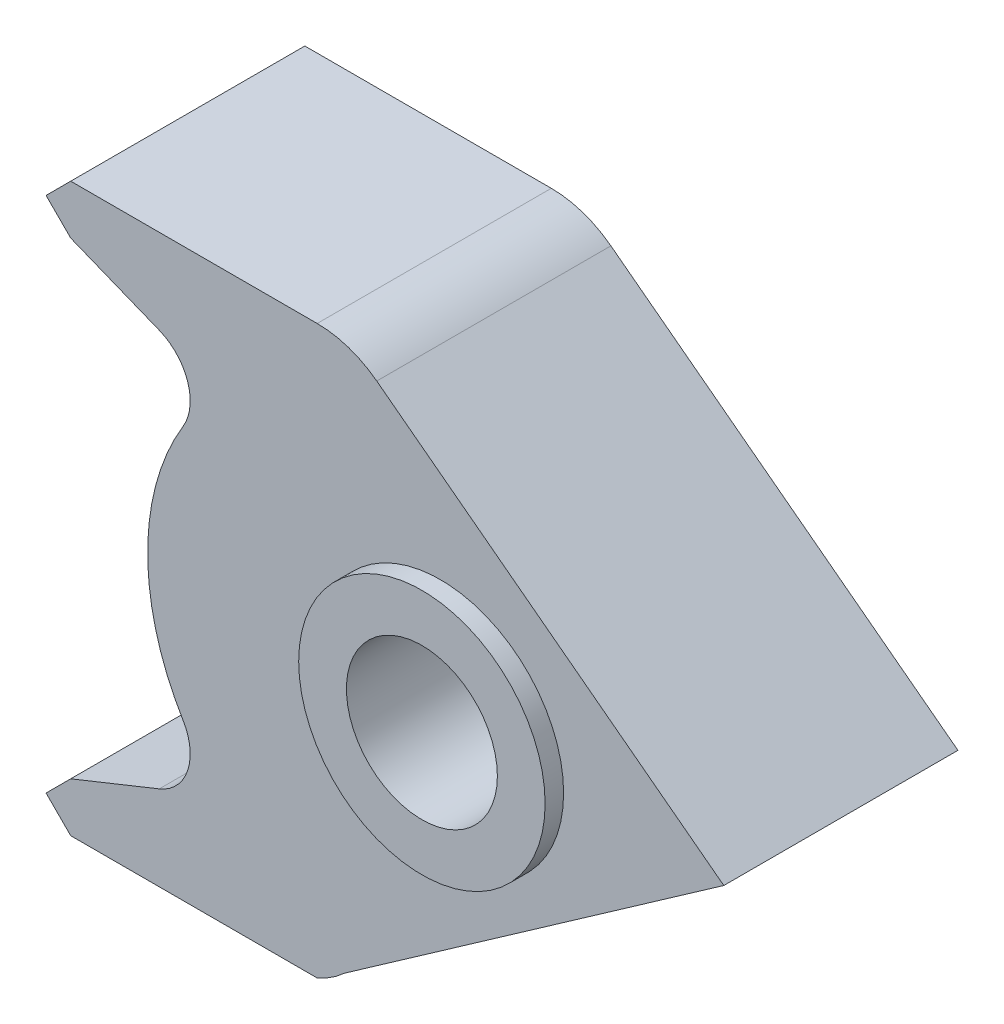
from build123d import *

# Parameters (mm, degrees)
ESBO_O1_R                = 6.125
RESSALTO_EXTRUS_O1_DEPTH = 22
ESBO_O2_OUTSIDE_W        = 72
ESBO_O2_OUTSIDE_H        = 63
ESBO_O2_OUTSIDE_R        = 10
CORTE_EXTRUS_O1_DEPTH    = 1.5
ESBO_O3_OUTSIDE_W        = 72
ESBO_O3_OUTSIDE_H        = 63
ESBO_O3_OUTSIDE_R        = 10
CORTE_EXTRUS_O2_DEPTH    = 1.5


with BuildPart() as part:
    # Esboço1 → Ressalto-extrusão1 (new body)
    with BuildSketch(Plane.XY):
        with BuildLine():
            ThreePointArc((-30.781182975, -21.553216354), (-31.830295908, -22.369078713), (-33, -23))
            Line((-33, -23), (-53, -23))
            Line((-53, -23), (-55, -21))
            Line((-55, -21), (-53, -19))
            Line((-53, -19), (-45.812043902, -16.114839283))
            ThreePointArc((-45.812043902, -16.114839283), (-43.50890364, -13.67237999), (-43.877574187, -10.335593438))
            ThreePointArc((-43.877574187, -10.335593438), (-46.755205534, 0), (-43.877574187, 10.335593438))
            ThreePointArc((-43.877574187, 10.335593438), (-43.50890364, 13.67237999), (-45.812043902, 16.114839283))
            Line((-45.812043902, 16.114839283), (-53, 19))
            Line((-53, 19), (-55, 21))
            Line((-55, 21), (-53, 23))
            Line((-53, 23), (-33, 23))
            ThreePointArc((-33, 23), (-30.448735361, 22.582285193), (-28.163895976, 21.372762185))
            Line((-28.163895976, 21.372762185), (0, 0))
            Line((0, 0), (-30.781182975, -21.553216354))
        make_face()
        with Locations((-23, 0)):
            Circle(ESBO_O1_R, mode=Mode.SUBTRACT)
    extrude(amount=RESSALTO_EXTRUS_O1_DEPTH)

    # Esboço2 outside → Corte-extrusão1 (cut)
    with BuildSketch(Plane.XY.offset(22)):
        with Locations((-27.5, 0)):
            Rectangle(ESBO_O2_OUTSIDE_W, ESBO_O2_OUTSIDE_H)
        with Locations((-23, 0)):
            Circle(ESBO_O2_OUTSIDE_R, mode=Mode.SUBTRACT)
    extrude(amount=-CORTE_EXTRUS_O1_DEPTH, mode=Mode.SUBTRACT)

    # Esboço3 outside → Corte-extrusão2 (cut)
    with BuildSketch(Plane(origin=(0, 0, 0), x_dir=(-1, 0, 0), z_dir=(0, 0, -1))):
        with Locations((27.5, 0)):
            Rectangle(ESBO_O3_OUTSIDE_W, ESBO_O3_OUTSIDE_H)
        with Locations(Location((23, 0, 0), (0, 0, 180))):
            Circle(ESBO_O3_OUTSIDE_R, mode=Mode.SUBTRACT)
    extrude(amount=-CORTE_EXTRUS_O2_DEPTH, mode=Mode.SUBTRACT)


solid = part.part
